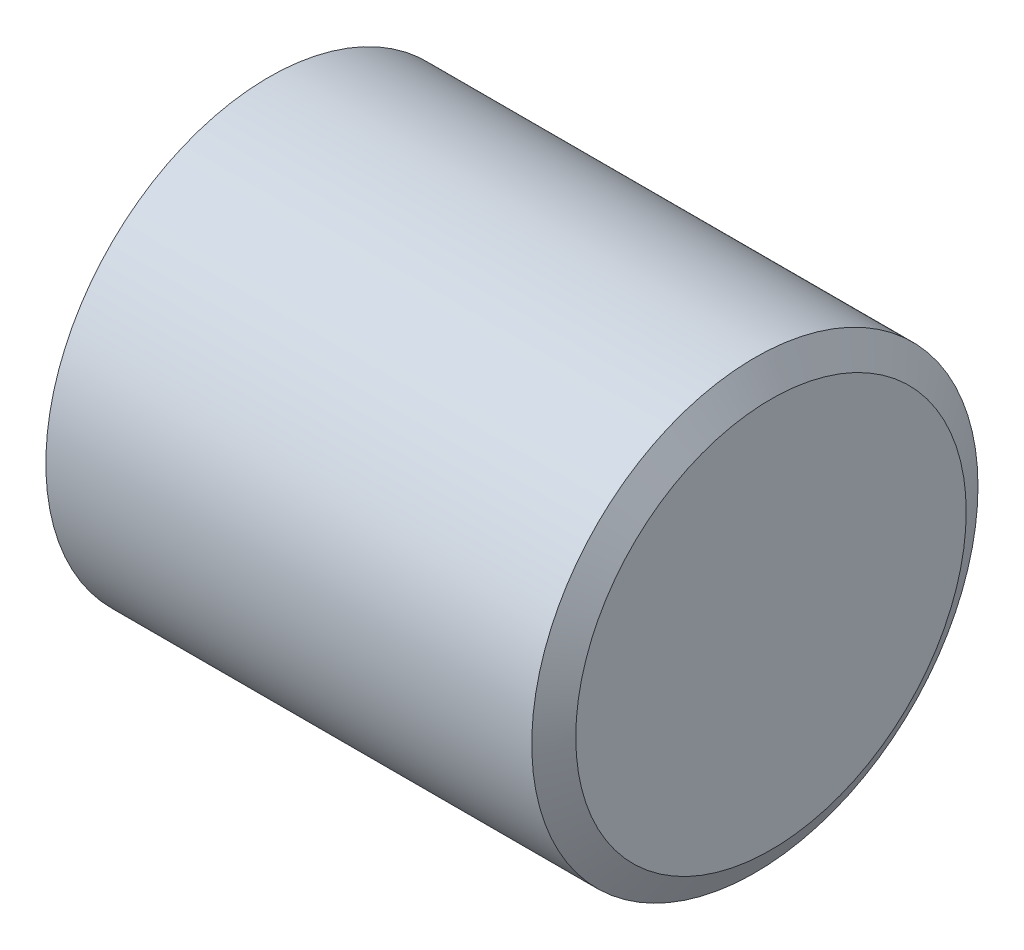
from build123d import *

# Parameters (mm, degrees)
CHAMFER1_SIZE  = 0.5
CHAMFER1_SIZE2 = 0.288675135


with BuildPart() as part:
    # Sketch1 → Revolve2 (revolve)
    with BuildSketch(Plane.XY, mode=Mode.PRIVATE) as revolve2_sk:
        Polygon((-3, 2.5), (-9, 2.5), (-9, 4), (0, 4), (0, 0), (-3, 0), align=None)
    revolve(revolve2_sk.sketch.rotate(Axis((0, 0, 0), (-1, 0, 0)), 90), axis=Axis((0, 0, 0), (-1, 0, 0)))

    # Chamfer1
    chamfer1_edges = [part.edges().sort_by_distance(p)[0] for p in [
        (0, 0, 4),
    ]]
    chamfer1_side = [part.faces().sort_by_distance(p)[0] for p in [
        (0, 0, 0),
    ]]
    chamfer(chamfer1_edges, length=CHAMFER1_SIZE, length2=CHAMFER1_SIZE2, reference=chamfer1_side[0])


solid = part.part
